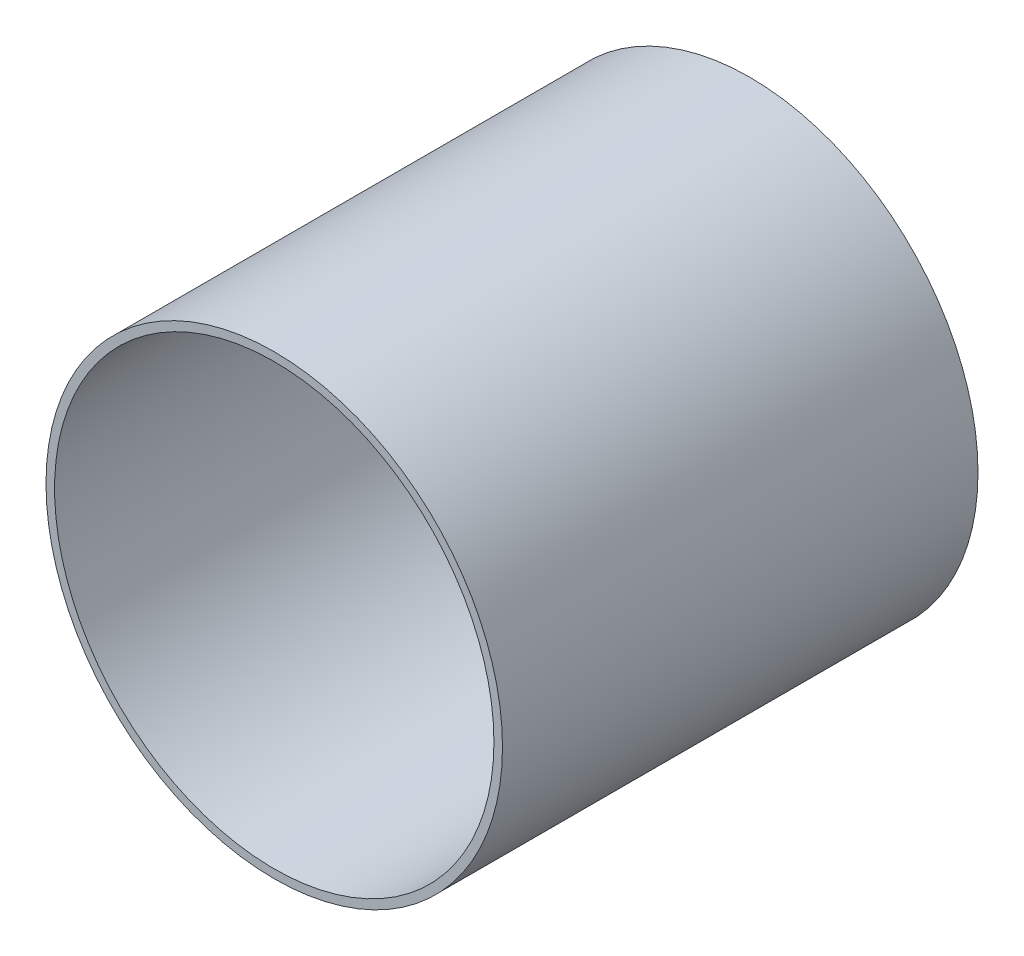
from build123d import *

# Parameters (mm, degrees)
SKETCH1_R           = 12
SKETCH1_R_2         = 11.55
BOSS_EXTRUDE1_DEPTH = 25


with BuildPart() as part:
    # Sketch1 → Boss-Extrude1 (new body)
    with BuildSketch(Plane.XY):
        Circle(SKETCH1_R)
        Circle(SKETCH1_R_2, mode=Mode.SUBTRACT)
    extrude(amount=BOSS_EXTRUDE1_DEPTH)


solid = part.part
